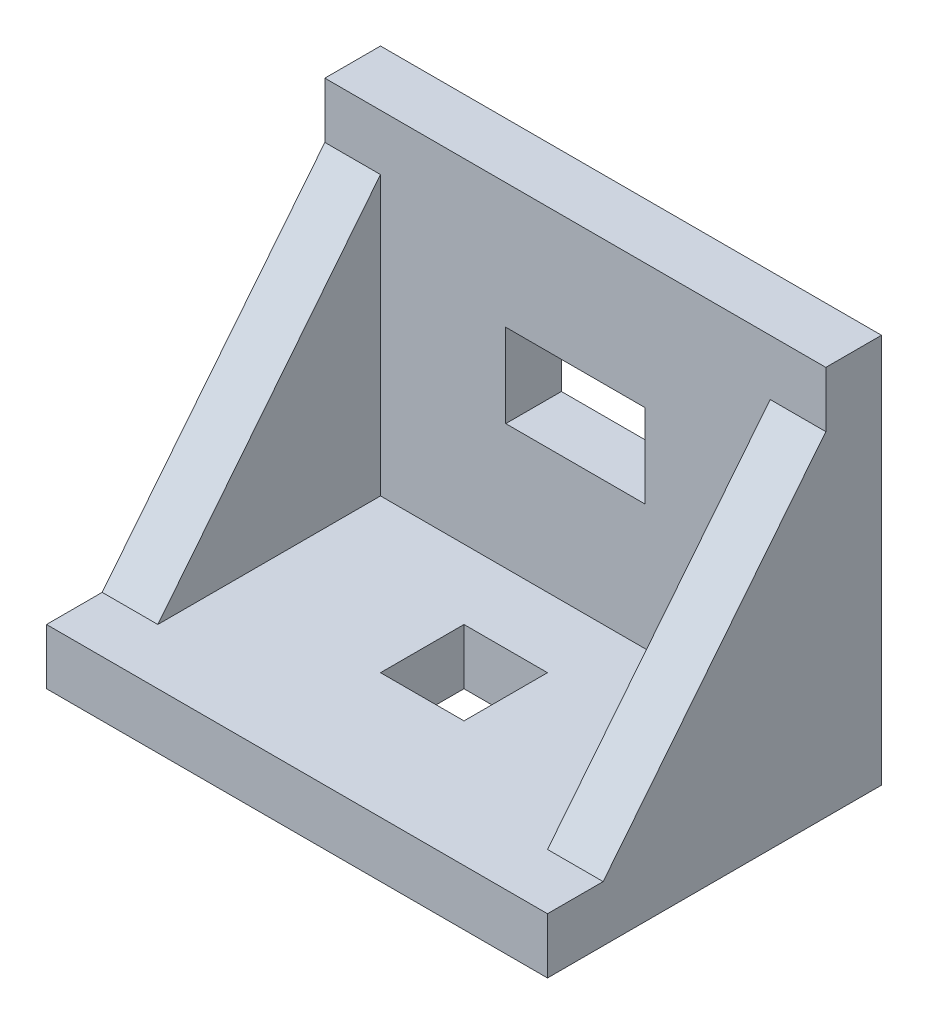
from build123d import *

# Parameters (mm, degrees)
SKETCH1_W           = 90
SKETCH1_H           = 60
BOSS_EXTRUDE1_DEPTH = 10
SKETCH2_W           = 90
SKETCH2_H           = 10
BOSS_EXTRUDE2_DEPTH = 60
SKETCH3_W           = 25
SKETCH3_H           = 15
CUT_EXTRUDE1_DEPTH  = 10
SKETCH5_W           = 15
SKETCH5_H           = 15
CUT_EXTRUDE2_DEPTH  = 10
RIB1_REACH          = 119.898
SKETCH6_WALL_W      = 301.827764826
SKETCH6_WALL_H      = 10


with BuildPart() as part:
    # Sketch1 → Boss-Extrude1 (new body)
    with BuildSketch(Plane(origin=(0, 0, 0), x_dir=(1, 0, 0), z_dir=(0, 1, 0))):
        Rectangle(SKETCH1_W, SKETCH1_H)
    extrude(amount=BOSS_EXTRUDE1_DEPTH)

    # Sketch2 → Boss-Extrude2 (add)
    with BuildSketch(Plane(origin=(0, 10, 0), x_dir=(1, 0, 0), z_dir=(0, 1, 0))):
        with Locations((0, 25)):
            Rectangle(SKETCH2_W, SKETCH2_H)
    extrude(amount=BOSS_EXTRUDE2_DEPTH)

    # Sketch3 → Cut-Extrude1 (cut)
    with BuildSketch(Plane.XY.offset(-20)):
        with Locations((0, 40)):
            Rectangle(SKETCH3_W, SKETCH3_H)
    extrude(amount=-CUT_EXTRUDE1_DEPTH, mode=Mode.SUBTRACT)

    # Sketch5 → Cut-Extrude2 (cut)
    with BuildSketch(Plane(origin=(0, 10, 0), x_dir=(1, 0, 0), z_dir=(0, 1, 0))):
        Rectangle(SKETCH5_W, SKETCH5_H)
    extrude(amount=-CUT_EXTRUDE2_DEPTH, mode=Mode.SUBTRACT)

    # Sketch6 wall → Rib1 (add, up to next)
    with BuildSketch(Plane(origin=(-45, 35, 0), x_dir=(0, 0.780868809443, -0.624695047554), z_dir=(0, -0.624695047554, -0.780868809443)), mode=Mode.PRIVATE) as rib1_sk1:
        with Locations((0, 5)):
            Rectangle(SKETCH6_WALL_W, SKETCH6_WALL_H)
    rib1_tool1 = extrude(rib1_sk1.sketch, amount=RIB1_REACH, mode=Mode.PRIVATE) - part.part
    rib1 = rib1_tool1.solids().sort_by_distance((-45, 35, 0))[0]
    add(rib1)

    # Mirror1: Rib1 across plane
    add(rib1.mirror(Plane(origin=(0, 0, 0), x_dir=(0, 0, 1), z_dir=(1, 0, 0))))


solid = part.part
